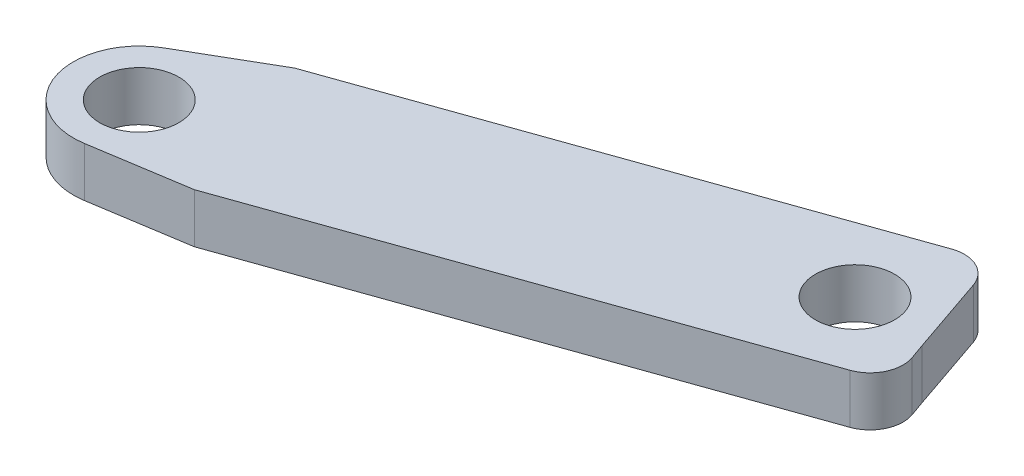
from build123d import *

# Parameters (mm, degrees)
SKETCH3_R           = 1
BOSS_EXTRUDE2_DEPTH = 1.5
MOVE_FACE1_BY       = 0.2
MOVE_FACE1_2_BY     = 0.2


with BuildPart() as part:
    # Sketch3 → Boss-Extrude2 (new body)
    with BuildSketch(Plane(origin=(0, 0, 0), x_dir=(1, 0, 0), z_dir=(0, 1, 0))):
        with BuildLine():
            Line((9.052045009, -11.69440211), (-2.494704275, -15.782345478))
            Line((-2.494704275, -15.782345478), (-2.714831854, -15.909670913))
            Line((-2.714831854, -15.909670913), (-5.018414472, -17.242101226))
            ThreePointArc((-5.018414472, -17.242101226), (-5.90236336, -19.640824396), (-3.706036939, -20.949024969))
            Line((-3.706036939, -20.949024969), (-1.077229318, -20.535220782))
            Line((-1.077229318, -20.535220782), (-0.82602363, -20.495678153))
            Line((-0.82602363, -20.495678153), (10.720725655, -16.407734785))
            Line((10.720725655, -16.407734785), (13.853836403, -15.298506639))
            ThreePointArc((13.853836403, -15.298506639), (14.422653253, -14.786418923), (14.462766809, -14.022103975))
            Line((14.462766809, -14.022103975), (14.300666867, -13.564238683))
            Line((14.300666867, -13.564238683), (13.487374274, -11.195126647))
            ThreePointArc((13.487374274, -11.195126647), (12.976450881, -10.619337061), (12.207817887, -10.577150797))
            Line((12.207817887, -10.577150797), (9.052045009, -11.69440211))
        make_face()
        with Locations(Location((-4.01703029, -18.973352138, 0), (0, 0, 270))):
            Circle(SKETCH3_R, mode=Mode.SUBTRACT)
        with Locations(Location((12.007385036, -13.300162157, 0), (0, 0, 270))):
            Circle(SKETCH3_R, mode=Mode.SUBTRACT)
    extrude(amount=BOSS_EXTRUDE2_DEPTH)

    # Move Face1: a curved face moved inward by 0.2
    add(Solid.thicken(part.faces().sort_by_distance((12.007385036, 0.75, 12.300162157))[0], -MOVE_FACE1_BY), mode=Mode.SUBTRACT)

    # Move Face1 2: a curved face moved inward by 0.2
    add(Solid.thicken(part.faces().sort_by_distance((-4.01703029, 0.75, 17.973352138))[0], -MOVE_FACE1_2_BY), mode=Mode.SUBTRACT)


solid = part.part
